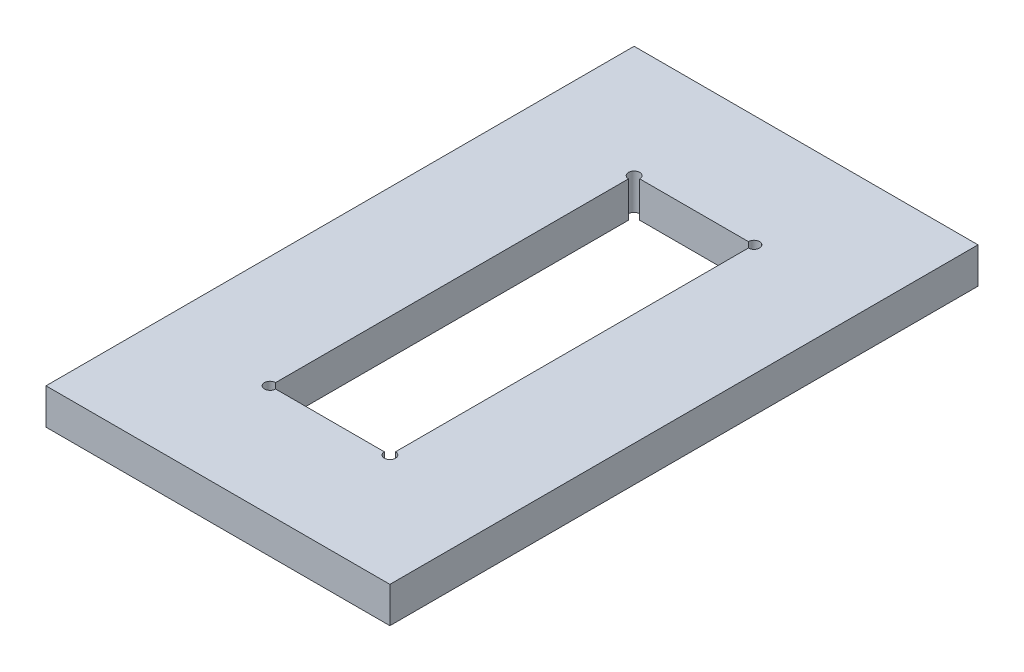
from build123d import *

# Parameters (mm, degrees)
SKETCH1_W           = 30.7
SKETCH1_H           = 52.5
BOSS_EXTRUDE1_DEPTH = 3.2


with BuildPart() as part:
    # Sketch1 → Boss-Extrude1 (new body)
    with BuildSketch(Plane(origin=(0, 0, 0), x_dir=(1, 0, 0), z_dir=(0, 1, 0))):
        with Locations((5.35, 16.25)):
            Rectangle(SKETCH1_W, SKETCH1_H)
        with BuildLine():
            Line((0.5, 0), (10.2, 0))
            ThreePointArc((10.2, 0), (11.053553391, -0.353553391), (10.7, 0.5))
            Line((10.7, 0.5), (10.7, 32))
            ThreePointArc((10.7, 32), (11.053553391, 32.853553391), (10.2, 32.5))
            Line((10.2, 32.5), (0.5, 32.5))
            ThreePointArc((0.5, 32.5), (-0.353553391, 32.853553391), (0, 32))
            Line((0, 32), (0, 0.5))
            ThreePointArc((0, 0.5), (-0.353553391, -0.353553391), (0.5, 0))
        make_face(mode=Mode.SUBTRACT)
    extrude(amount=BOSS_EXTRUDE1_DEPTH)


solid = part.part
